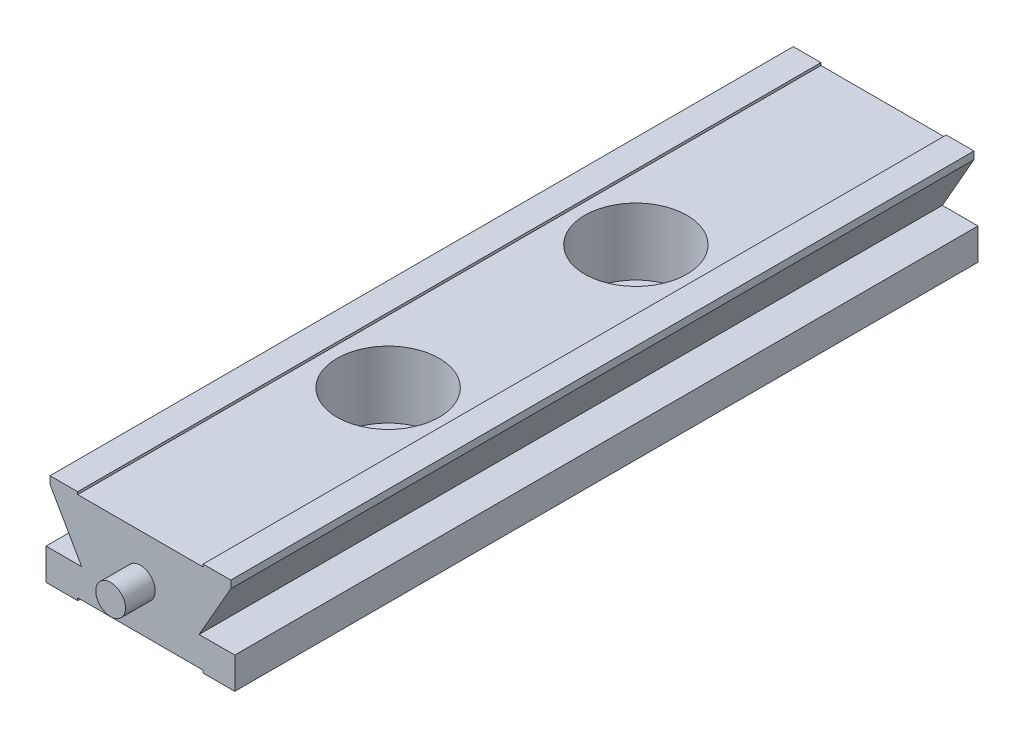
from build123d import *

# Parameters (mm, degrees)
BOSS_EXTRUDE1_DEPTH = 75
SKETCH3_R           = 5.155
CUT_EXTRUDE2_DEPTH  = 6.73
SKETCH4_R           = 3.365
CUT_EXTRUDE3_DEPTH  = 2.54
SKETCH5_R           = 1.5
CUT_EXTRUDE4_DEPTH  = 3
SKETCH6_R           = 1.5
BOSS_EXTRUDE2_DEPTH = 3


with BuildPart() as part:
    # Sketch1 → Boss-Extrude1 (new body)
    with BuildSketch(Plane.XY):
        Polygon((6.3246, 9.017), (6.3246, 9.271), (9.1186, 9.271), (9.1186, 8.509), (5.926144338, 2.921), (9.525, 2.921), (9.525, -0.254), (6.3246, -0.254), (6.3246, 0), (-6.3246, 0), (-6.3246, -0.254), (-9.525, -0.254), (-9.525, 2.921), (-5.926144338, 2.921), (-9.1186, 8.509), (-9.1186, 9.271), (-6.3246, 9.271), (-6.3246, 9.017), align=None)
    extrude(amount=-BOSS_EXTRUDE1_DEPTH)

    # Sketch3 → Cut-Extrude2 (cut)
    with BuildSketch(Plane(origin=(0, 9.017, 0), x_dir=(1, 0, 0), z_dir=(0, 1, 0))):
        with Locations(Location((0, 25, 0), (0, 0, 180))):
            Circle(SKETCH3_R)
        with Locations(Location((0, 50, 0), (0, 0, 180))):
            Circle(SKETCH3_R)
    extrude(amount=-CUT_EXTRUDE2_DEPTH, mode=Mode.SUBTRACT)

    # Sketch4 → Cut-Extrude3 (cut)
    with BuildSketch(Plane.XZ):
        with Locations((0, -25)):
            Circle(SKETCH4_R)
        with Locations((0, -50)):
            Circle(SKETCH4_R)
    extrude(amount=-CUT_EXTRUDE3_DEPTH, mode=Mode.SUBTRACT)

    # Sketch5 → Cut-Extrude4 (cut)
    with BuildSketch(Plane(origin=(0, 0, -75), x_dir=(-1, 0, 0), z_dir=(0, 0, -1))):
        with Locations((0, 4.5085)):
            Circle(SKETCH5_R)
    extrude(amount=-CUT_EXTRUDE4_DEPTH, mode=Mode.SUBTRACT)

    # Sketch6 → Boss-Extrude2 (add)
    with BuildSketch(Plane.XY):
        with Locations(Location((0, 4.5085, 0), (0, 0, 180))):
            Circle(SKETCH6_R)
    extrude(amount=BOSS_EXTRUDE2_DEPTH)


solid = part.part
